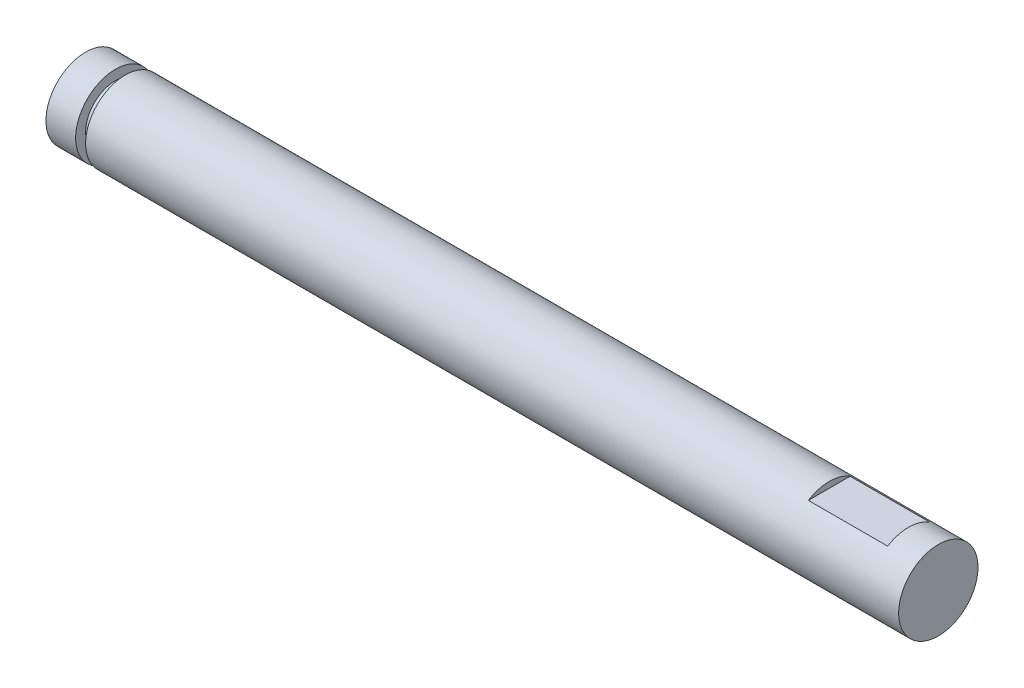
from build123d import *

# Parameters (mm, degrees)
CUT_EXTRUDE1_START = 2
SKETCH2_W          = 4
SKETCH2_H          = 4
CUT_EXTRUDE1_DEPTH = 0.3


with BuildPart() as part:
    # Sketch1 → Revolve1 (revolve)
    with BuildSketch(Plane.XY, mode=Mode.PRIVATE) as revolve1_sk:
        Polygon((21.5, 0), (-21.5, 0), (-21.5, 2), (-20, 2), (-20, 1.5), (-19.5, 1.5), (-19.5, 2), (21.5, 2), align=None)
    revolve(revolve1_sk.sketch.rotate(Axis((-21.5, 0, 0), (-1, 0, 0)), 90), axis=Axis((-21.5, 0, 0), (-1, 0, 0)))

    # Sketch2 → Cut-Extrude1 (cut)
    with BuildSketch(Plane(origin=(0, 0, 0), x_dir=(1, 0, 0), z_dir=(0, 1, 0)).offset(CUT_EXTRUDE1_START)):
        with Locations((18, 0)):
            Rectangle(SKETCH2_W, SKETCH2_H)
    extrude(amount=-CUT_EXTRUDE1_DEPTH, mode=Mode.SUBTRACT)


solid = part.part
